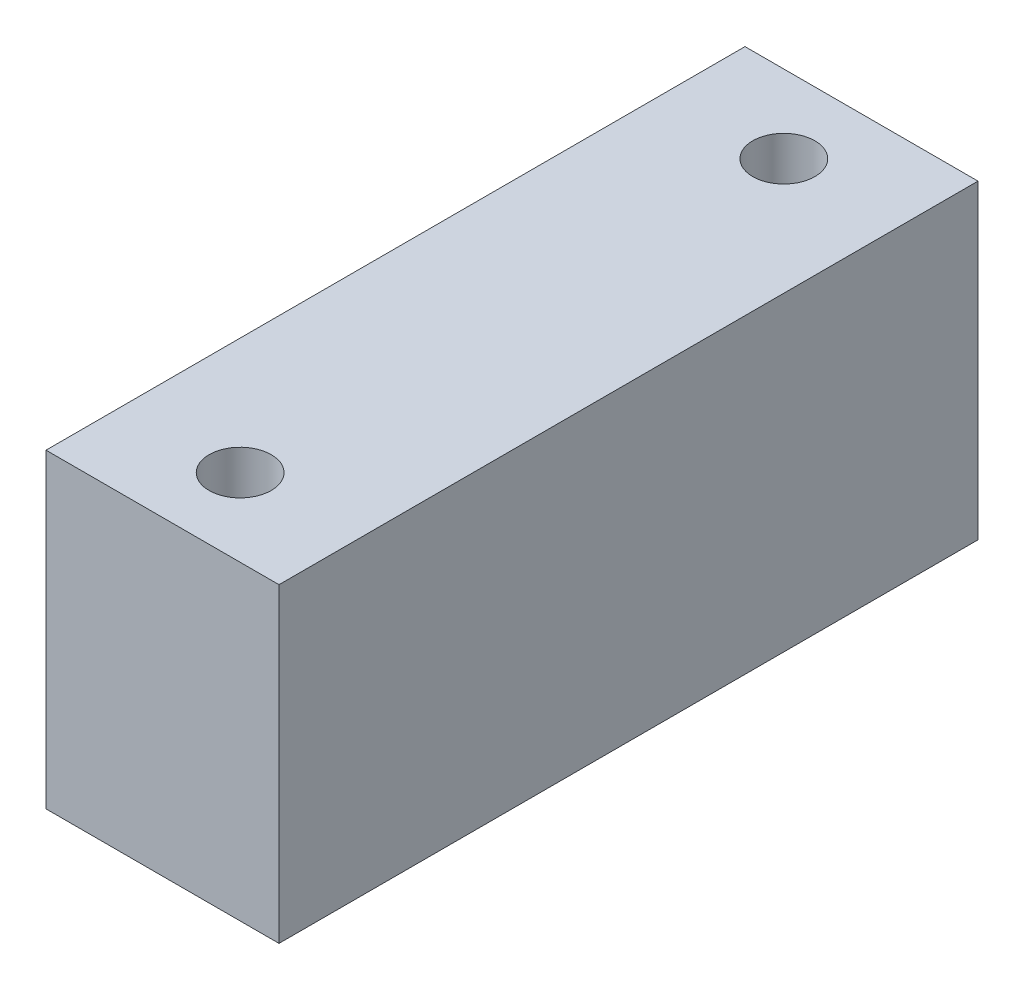
from build123d import *

# Parameters (mm, degrees)
SKETCH1_W           = 30
SKETCH1_H           = 90
SKETCH1_R           = 4
BOSS_EXTRUDE1_DEPTH = 40


with BuildPart() as part:
    # Sketch1 → Boss-Extrude1 (new body)
    with BuildSketch(Plane(origin=(0, 0, 0), x_dir=(1, 0, 0), z_dir=(0, 1, 0))):
        Rectangle(SKETCH1_W, SKETCH1_H)
        with Locations(Location((0, 35, 0), (0, 0, 270))):
            Circle(SKETCH1_R, mode=Mode.SUBTRACT)
        with Locations(Location((0, -35, 0), (0, 0, 90))):
            Circle(SKETCH1_R, mode=Mode.SUBTRACT)
    extrude(amount=BOSS_EXTRUDE1_DEPTH)


solid = part.part
